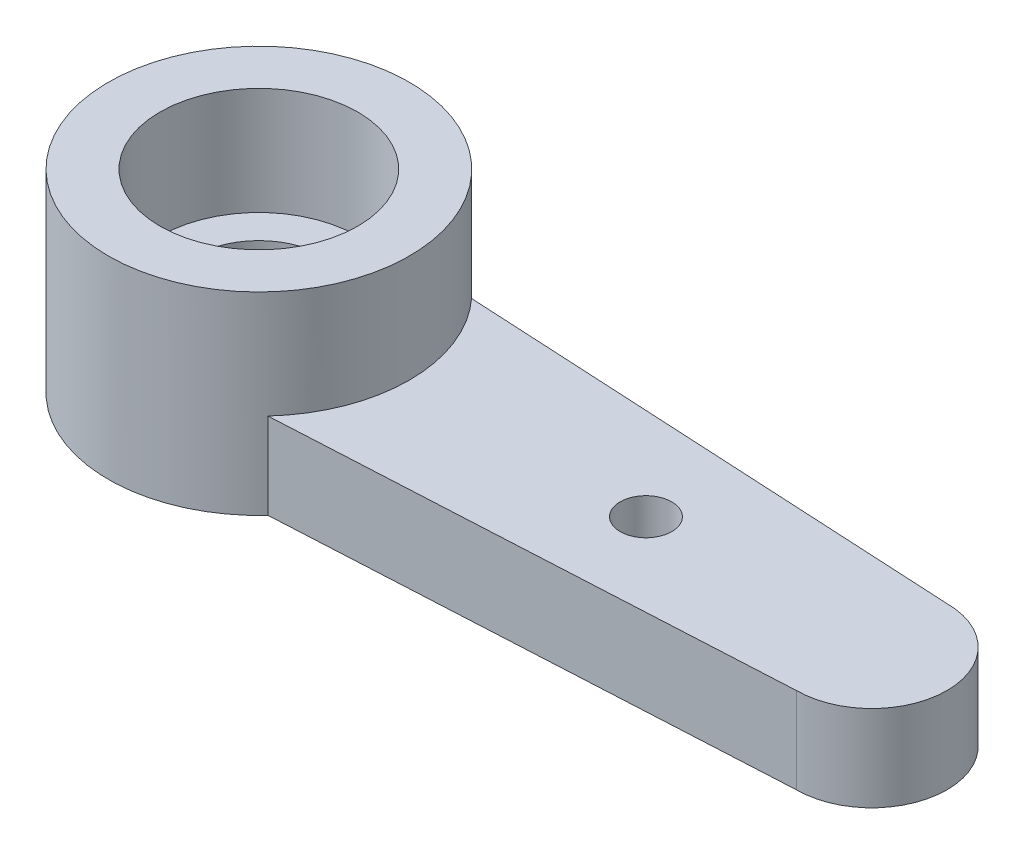
from build123d import *

# Parameters (mm, degrees)
SKETCH1_R           = 2.3
BOSS_EXTRUDE1_DEPTH = 2.5
BOSS_EXTRUDE2_START = -2
SKETCH1_3_R         = 2.3
BOSS_EXTRUDE2_DEPTH = 2
BOSS_EXTRUDE3_START = -1
SKETCH2_R           = 2.3
SKETCH2_R_2         = 1.5
BOSS_EXTRUDE3_DEPTH = 1
SKETCH3_R           = 0.6
CUT_EXTRUDE1_DEPTH  = 10


with BuildPart() as part:
    # Sketch1 → Boss-Extrude1 (new body)
    with BuildSketch(Plane(origin=(0, 0, 0), x_dir=(1, 0, 0), z_dir=(0, 1, 0))):
        with BuildLine():
            ThreePointArc((3.5, 0), (3.261386166, 1.270181198), (2.578079842, 2.367172221))
            ThreePointArc((2.578079842, 2.367172221), (-3.5, 0), (2.578079842, -2.367172221))
            ThreePointArc((2.578079842, -2.367172221), (3.261386166, -1.270181198), (3.5, 0))
        make_face()
        Circle(SKETCH1_R, mode=Mode.SUBTRACT)
    extrude(amount=BOSS_EXTRUDE1_DEPTH)

    # Sketch1<3> → Boss-Extrude2 (add)
    with BuildSketch(Plane(origin=(0, 0, 0), x_dir=(1, 0, 0), z_dir=(0, 1, 0)).offset(BOSS_EXTRUDE2_START)):
        with BuildLine():
            ThreePointArc((14.25, -1.75), (16, 0), (14.25, 1.75))
            Line((14.25, 1.75), (2.578079842, 2.367172221))
            ThreePointArc((2.578079842, 2.367172221), (-3.5, 0), (2.578079842, -2.367172221))
            Line((2.578079842, -2.367172221), (14.25, -1.75))
        make_face()
        Circle(SKETCH1_3_R, mode=Mode.SUBTRACT)
    extrude(amount=BOSS_EXTRUDE2_DEPTH)

    # Sketch2 → Boss-Extrude3 (add)
    with BuildSketch(Plane(origin=(0, 0, 0), x_dir=(1, 0, 0), z_dir=(0, 1, 0)).offset(BOSS_EXTRUDE3_START)):
        Circle(SKETCH2_R)
        Circle(SKETCH2_R_2, mode=Mode.SUBTRACT)
    extrude(amount=BOSS_EXTRUDE3_DEPTH)

    # Sketch3 → Cut-Extrude1 (cut)
    with BuildSketch(Plane.XZ.offset(2)):
        with Locations((9, 0)):
            Circle(SKETCH3_R)
    extrude(amount=-CUT_EXTRUDE1_DEPTH, mode=Mode.SUBTRACT)


solid = part.part
